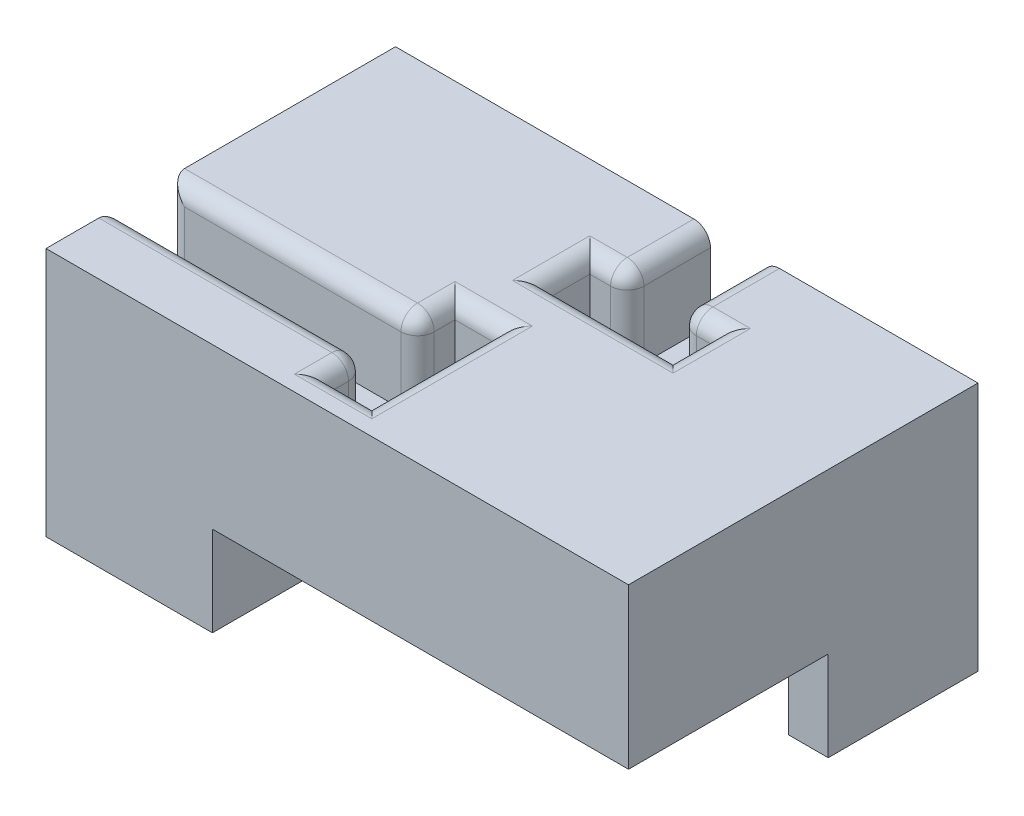
from build123d import *

# Parameters (mm, degrees)
SKETCH1_W               = 35
SKETCH1_H               = 21
BOSS_EXTRUDE1_DEPTH     = 15
SKETCH2_W               = 15
SKETCH2_H               = 5.4
CUT_EXTRUDE1_DEPTH      = 32.6
CUT_EXTRUDE2_DEPTH      = 5
FILLET1_R               = 1
CUT_EXTRUDE3_DEPTH      = 6
CUT_EXTRUDE3_DEPTH_BACK = 28.5
SKETCH4_W               = 25
SKETCH4_H               = 5.4


with BuildPart() as part:
    # Sketch1 → Boss-Extrude1 (new body)
    with BuildSketch(Plane(origin=(0, 0, 0), x_dir=(1, 0, 0), z_dir=(0, 1, 0))):
        Rectangle(SKETCH1_W, SKETCH1_H)
    extrude(amount=BOSS_EXTRUDE1_DEPTH)

    # Sketch2 → Cut-Extrude1 (cut)
    with BuildSketch(Plane.ZY.offset(17.5)):
        with Locations((-3, 2.7)):
            Rectangle(SKETCH2_W, SKETCH2_H)
    extrude(amount=-CUT_EXTRUDE1_DEPTH, mode=Mode.SUBTRACT)

    # Sketch3 → Cut-Extrude2 (cut)
    with BuildSketch(Plane(origin=(0, 15, 0), x_dir=(1, 0, 0), z_dir=(0, 1, 0))):
        Polygon((0.15, -0.925), (0.15, -8.575), (-2.5, -8.575), (-2.5, -6.325), (-17.5, -6.325), (-17.5, -3.175), (-2.5, -3.175), (-2.5, -0.925), align=None)
        Polygon((1.425, 10.5), (4.575, 10.5), (4.575, 5.5), (6.825, 5.5), (6.825, 2.85), (-0.825, 2.85), (-0.825, 5.5), (1.425, 5.5), align=None)
    extrude(amount=-CUT_EXTRUDE2_DEPTH, mode=Mode.SUBTRACT)

    # Fillet1
    fillet1_edges = [part.edges().sort_by_distance(p)[0] for p in [
        (-2.5, 12.5, 6.325),
        (-17.5, 12.5, 6.325),
        (-17.5, 12.5, 3.175),
        (-2.5, 12.5, 3.175),
        (-1.175, 15, 0.925),
        (-2.5, 15, 2.05),
        (-10, 15, 3.175),
        (-10, 15, 6.325),
        (-2.5, 15, 7.45),
        (-1.175, 15, 8.575),
        (0.15, 15, 4.75),
        (1.425, 12.5, -5.5),
        (4.575, 12.5, -5.5),
        (1.425, 15, -8),
        (0.3, 15, -5.5),
        (-0.825, 15, -4.175),
        (3, 15, -2.85),
        (6.825, 15, -4.175),
        (5.7, 15, -5.5),
        (4.575, 15, -8),
    ]]
    fillet(fillet1_edges, radius=FILLET1_R)

    # Sketch4 → Cut-Extrude3 (cut, two sides: drawn at the far end of the back side and taken through both)
    with BuildSketch(Plane(origin=(0, 0, 4.5), x_dir=(-1, 0, 0), z_dir=(0, 0, -1)).offset(-CUT_EXTRUDE3_DEPTH_BACK)):
        with Locations((-5, 2.7)):
            Rectangle(SKETCH4_W, SKETCH4_H)
    extrude(amount=CUT_EXTRUDE3_DEPTH + CUT_EXTRUDE3_DEPTH_BACK, mode=Mode.SUBTRACT)


solid = part.part
